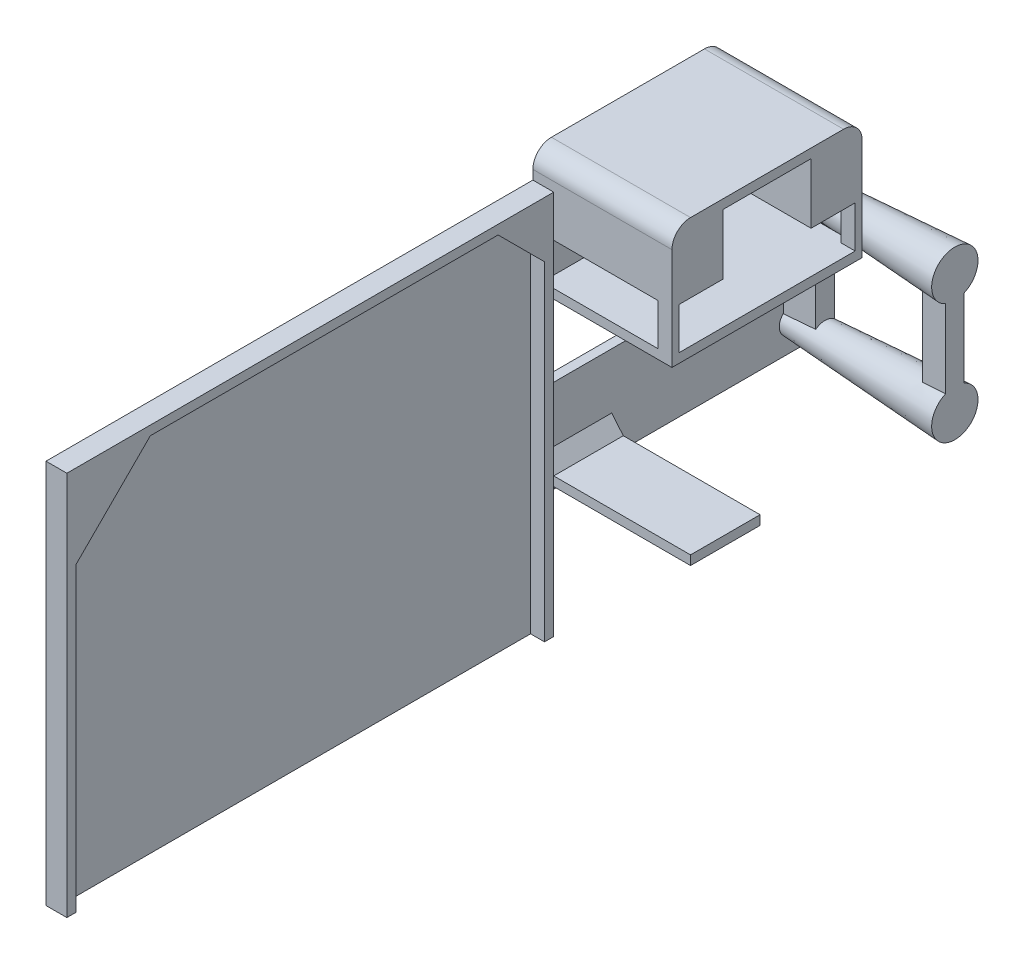
from build123d import *

# Parameters (mm, degrees)
SKETCH6_W            = 105
SKETCH6_H            = 83
BOSS_EXTRUDE3_DEPTH  = 4.5
SKETCH9_W            = 3
SKETCH9_H            = 101
CUT_EXTRUDE6_DEPTH   = 81
SKETCH10_W           = 1
SKETCH10_H           = 8
BOSS_EXTRUDE4_DEPTH  = 8
SKETCH11_W           = 1.226225524
SKETCH11_H           = 5
BOSS_EXTRUDE5_DEPTH  = 5
BOSS_EXTRUDE12_DEPTH = 1.226226
SKETCH27_W           = 15
SKETCH27_H           = 2
SKETCH27_W_2         = 41
SKETCH27_W_3         = 11
SKETCH27_H_2         = 15
BOSS_EXTRUDE20_DEPTH = 30
SKETCH28_W           = 1.5
SKETCH28_H           = 11
BOSS_EXTRUDE21_DEPTH = 3
SKETCH29_W           = 41
SKETCH29_H           = 2
BOSS_EXTRUDE22_DEPTH = 30
SKETCH30_W           = 2
SKETCH30_H           = 38
BOSS_EXTRUDE23_DEPTH = 60
SKETCH31_R           = 5
BOSS_EXTRUDE24_DEPTH = 35
DRAFT1_ANGLE         = -3.5
DRAFT3_ANGLE         = -3.5
SKETCH32_W           = 4
SKETCH32_H           = 28
BOSS_EXTRUDE25_DEPTH = 7
SKETCH33_W           = 4
SKETCH33_H           = 26
BOSS_EXTRUDE26_DEPTH = 5
SKETCH39_W           = 41
SKETCH39_H           = 24
BOSS_EXTRUDE30_DEPTH = 2
SKETCH40_R           = 5
CUT_EXTRUDE9_DEPTH   = 2
BOSS_EXTRUDE31_DEPTH = 15
SKETCH42_W           = 15
SKETCH42_H           = 2
BOSS_EXTRUDE32_DEPTH = 4
SKETCH45_W           = 30
SKETCH45_H           = 18
CUT_EXTRUDE10_DEPTH  = 5
FILLET1_R            = 4
FILLET2_R            = 4


with BuildPart() as part:
    # Sketch6 → Boss-Extrude3 (new body)
    with BuildSketch(Plane(origin=(0, 0, 0), x_dir=(0, 0, -1), z_dir=(1, 0, 0))):
        with Locations((52.5, -41.5)):
            Rectangle(SKETCH6_W, SKETCH6_H)
    extrude(amount=BOSS_EXTRUDE3_DEPTH)

    # Sketch9 → Cut-Extrude6 (cut)
    with BuildSketch(Plane.XZ.offset(83)):
        with Locations((3, -52.5)):
            Rectangle(SKETCH9_W, SKETCH9_H)
    extrude(amount=-CUT_EXTRUDE6_DEPTH, mode=Mode.SUBTRACT)

    # Sketch10 → Boss-Extrude4 (add)
    with BuildSketch(Plane(origin=(0, 0, -2), x_dir=(-1, 0, 0), z_dir=(0, 0, -1))):
        with Locations((-4, -6)):
            Rectangle(SKETCH10_W, SKETCH10_H)
    extrude(amount=BOSS_EXTRUDE4_DEPTH)

    # Sketch11 → Boss-Extrude5 (add)
    with BuildSketch(Plane.XY.offset(-103)):
        with Locations((3.886887238, -4.5)):
            Rectangle(SKETCH11_W, SKETCH11_H)
    extrude(amount=BOSS_EXTRUDE5_DEPTH)

    # Sketch18 → Boss-Extrude12 (add)
    with BuildSketch(Plane(origin=(4.5, 0, 0), x_dir=(0, 0, -1), z_dir=(1, 0, 0))):
        Polygon((103, -12), (93, -2), (103, -2), align=None)
        Polygon((18, -2), (2, -2), (2, -18), align=None)
    extrude(amount=-BOSS_EXTRUDE12_DEPTH)

    # Sketch27 → Boss-Extrude20 (add)
    with BuildSketch(Plane.ZY):
        with Locations((-112.5, -54)):
            Rectangle(SKETCH27_W, SKETCH27_H)
        with Locations((-125.5, -19)):
            Rectangle(SKETCH27_W_2, SKETCH27_H)
        with Locations((-110.5, -1.5)):
            Rectangle(SKETCH27_W_3, SKETCH27_H_2)
        with Locations((-140.5, -1.5)):
            Rectangle(SKETCH27_W_3, SKETCH27_H_2)
    extrude(amount=-BOSS_EXTRUDE20_DEPTH)


with BuildPart() as boss_extrude20_piece_1:
    # of the separate pieces the step leaves, piece 1, a body of its own (boss_extrude20_pieces)
    add(part.part.solids().sort_by_distance((0, 0, 0))[0])



with BuildPart() as boss_extrude20_piece_2:
    # of the separate pieces the step leaves, piece 2, a body of its own (boss_extrude20_pieces)
    add(part.part.solids().sort_by_distance((0, 6, -146))[0])


with BuildPart() as boss_extrude20_piece_1_1:
    add(boss_extrude20_piece_1.part)

    add(boss_extrude20_piece_2.part)  # Boss-Extrude21 merges Boss-Extrude20 piece 2
    # Sketch28 → Boss-Extrude21 (add)
    with BuildSketch(Plane(origin=(30, 0, 0), x_dir=(0, 0, -1), z_dir=(1, 0, 0))):
        with Locations((145.25, -14.5)):
            Rectangle(SKETCH28_W, SKETCH28_H)
        with Locations((105.75, -14.5)):
            Rectangle(SKETCH28_W, SKETCH28_H)
    extrude(amount=-BOSS_EXTRUDE21_DEPTH)

    # Sketch29 → Boss-Extrude22 (add)
    with BuildSketch(Plane(origin=(30, 0, 0), x_dir=(0, 0, -1), z_dir=(1, 0, 0))):
        with Locations((125.5, 5)):
            Rectangle(SKETCH29_W, SKETCH29_H)
    extrude(amount=-BOSS_EXTRUDE22_DEPTH)

    # Sketch30 → Boss-Extrude23 (add)
    with BuildSketch(Plane(origin=(0, 0, -105), x_dir=(-1, 0, 0), z_dir=(0, 0, -1))):
        with Locations((-1, -39)):
            Rectangle(SKETCH30_W, SKETCH30_H)
    extrude(amount=BOSS_EXTRUDE23_DEPTH)

    # Sketch31 → Boss-Extrude24 (add)
    with BuildSketch(Plane(origin=(2, 0, 0), x_dir=(0, 0, -1), z_dir=(1, 0, 0))):
        with Locations(Location((159, -52, 0), (0, 0, 180))):
            Circle(SKETCH31_R)
        with Locations(Location((159, -26, 0), (0, 0, 180))):
            Circle(SKETCH31_R)
    extrude(amount=BOSS_EXTRUDE24_DEPTH)

    # Draft1
    draft1_faces = [boss_extrude20_piece_1_1.faces().sort_by_distance(p)[0] for p in [
        (19.5, -52, -164),
    ]]
    draft(draft1_faces, Plane(origin=(37, -52, -159), x_dir=(0, 0, 1), z_dir=(1, 0, 0)), DRAFT1_ANGLE)

    # Draft3
    draft3_faces = [boss_extrude20_piece_1_1.faces().sort_by_distance(p)[0] for p in [
        (19.5, -26, -164),
    ]]
    draft(draft3_faces, Plane(origin=(37, -26, -159), x_dir=(0, 0, 1), z_dir=(1, 0, 0)), DRAFT3_ANGLE)

    # Sketch32 → Boss-Extrude25 (add)
    with BuildSketch(Plane(origin=(2, 0, 0), x_dir=(0, 0, -1), z_dir=(1, 0, 0))):
        with Locations((159, -39)):
            Rectangle(SKETCH32_W, SKETCH32_H)
    extrude(amount=BOSS_EXTRUDE25_DEPTH)

    # Sketch33 → Boss-Extrude26 (add)
    with BuildSketch(Plane(origin=(37, 0, 0), x_dir=(0, 0, -1), z_dir=(1, 0, 0))):
        with Locations((159, -39)):
            Rectangle(SKETCH33_W, SKETCH33_H)
    extrude(amount=-BOSS_EXTRUDE26_DEPTH)

    # Sketch39 → Boss-Extrude30 (add)
    with BuildSketch(Plane.ZY):
        with Locations((-125.5, -6)):
            Rectangle(SKETCH39_W, SKETCH39_H)
    extrude(amount=-BOSS_EXTRUDE30_DEPTH)

    # Sketch40 → Cut-Extrude9 (cut)
    with BuildSketch(Plane(origin=(2, 0, 0), x_dir=(0, 0, -1), z_dir=(1, 0, 0))):
        with Locations((125.5, -6.5)):
            Circle(SKETCH40_R)
    extrude(amount=-CUT_EXTRUDE9_DEPTH, mode=Mode.SUBTRACT)

    # Sketch41 → Boss-Extrude31 (add)
    with BuildSketch(Plane(origin=(0, 0, -120), x_dir=(-1, 0, 0), z_dir=(0, 0, -1))):
        Polygon((-2, -55), (-2, -58), (-4.5, -55), align=None)
        Polygon((-2, -50), (-4.5, -53), (-2, -53), align=None)
    extrude(amount=-BOSS_EXTRUDE31_DEPTH)

    # Sketch42 → Boss-Extrude32 (add)
    with BuildSketch(Plane(origin=(30, 0, 0), x_dir=(0, 0, -1), z_dir=(1, 0, 0))):
        with Locations((112.5, -54)):
            Rectangle(SKETCH42_W, SKETCH42_H)
    extrude(amount=BOSS_EXTRUDE32_DEPTH)

    # Sketch45 → Cut-Extrude10 (cut)
    with BuildSketch(Plane(origin=(2, 0, 0), x_dir=(0, 0, -1), z_dir=(1, 0, 0))):
        with Locations((120, -29)):
            Rectangle(SKETCH45_W, SKETCH45_H)
    extrude(amount=-CUT_EXTRUDE10_DEPTH, mode=Mode.SUBTRACT)

    # Fillet1
    fillet1_edges = [boss_extrude20_piece_1_1.edges().sort_by_distance(p)[0] for p in [
        (15, 6, -146),
    ]]
    fillet(fillet1_edges, radius=FILLET1_R)

    # Fillet2
    fillet2_edges = [boss_extrude20_piece_1_1.edges().sort_by_distance(p)[0] for p in [
        (15, 6, -105),
    ]]
    fillet(fillet2_edges, radius=FILLET2_R)


solid = boss_extrude20_piece_1_1.part
